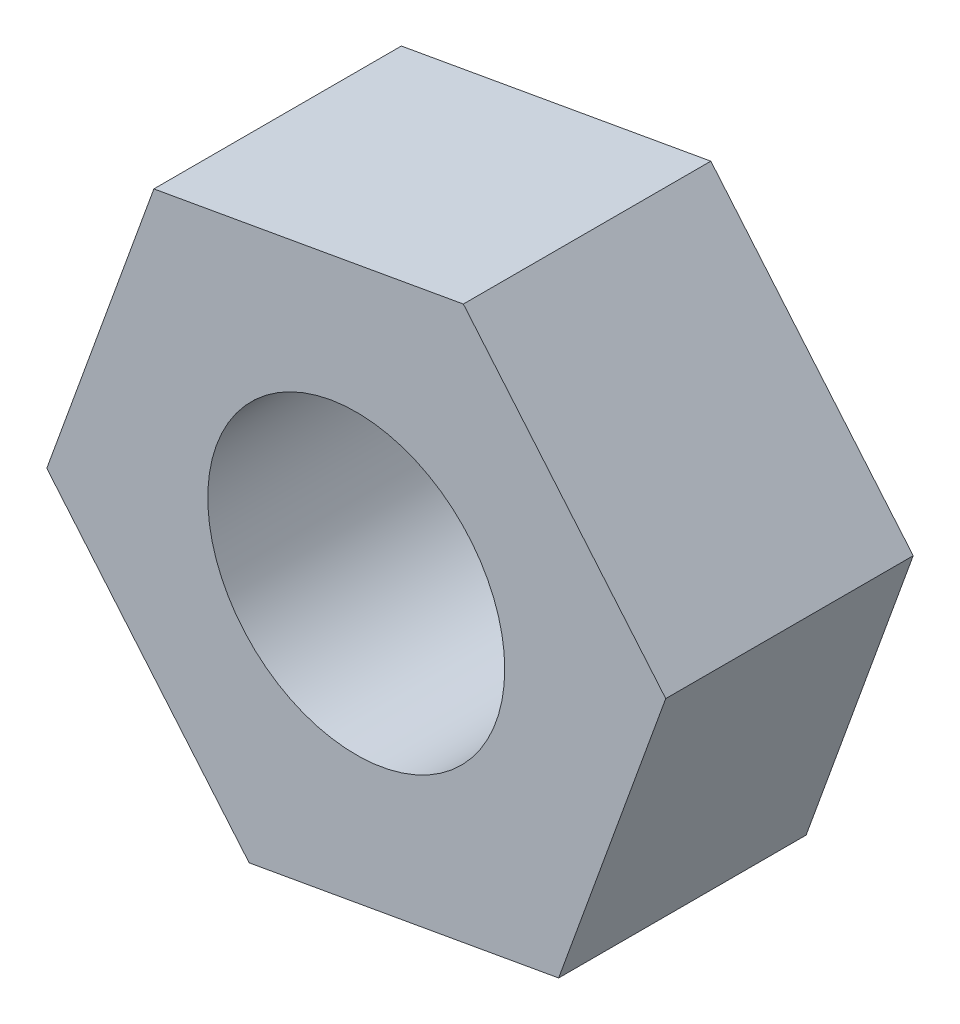
from build123d import *

# Parameters (mm, degrees)
SKETCH1_R           = 1.5
BOSS_EXTRUDE1_DEPTH = 2.5


with BuildPart() as part:
    # Sketch1 → Boss-Extrude1 (new body)
    with BuildSketch(Plane.XY):
        Polygon((2.044493118, -2.429687474), (3.126417635, 0.555739241), (1.081924517, 2.985426716), (-2.044493118, 2.429687474), (-3.126417635, -0.555739241), (-1.081924517, -2.985426716), align=None)
        Circle(SKETCH1_R, mode=Mode.SUBTRACT)
    extrude(amount=BOSS_EXTRUDE1_DEPTH)


solid = part.part
